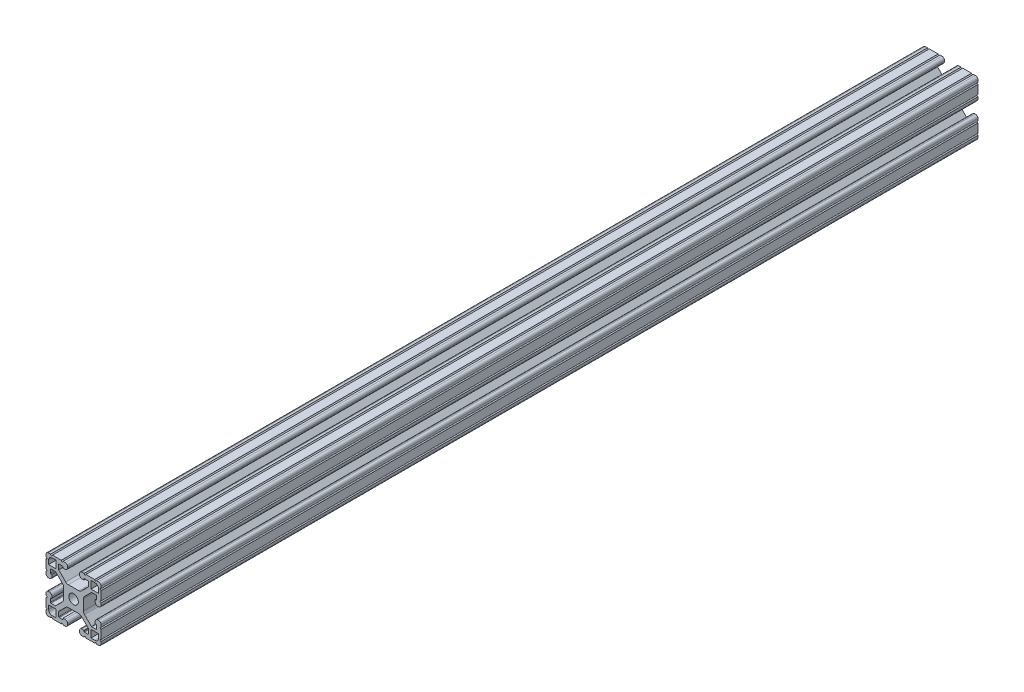
from build123d import *

# Parameters (mm, degrees)
BOSS_EXTRUDE1_DEPTH      = 303.2125
BOSS_EXTRUDE1_DEPTH_BACK = 303.2125
SKETCH3_W                = 38.1
SKETCH3_H                = 38.1
SKETCH4_W                = 5.207
SKETCH4_H                = 5.207
SKETCH4_R                = 3.302
CUT_EXTRUDE1_DEPTH       = 608.023134341
CUT_EXTRUDE2_DEPTH       = 608.023134341
FILLET1_R                = 2.54
FILLET2_R                = 1.778
FILLET3_R                = 0.396875


with BuildPart() as part:
    # Sketch3 → Boss-Extrude1 (new, two sides: drawn at the far end of the back side and taken through both)
    with BuildSketch(Plane.XY.offset(-BOSS_EXTRUDE1_DEPTH_BACK)):
        Rectangle(SKETCH3_W, SKETCH3_H)
    extrude(amount=BOSS_EXTRUDE1_DEPTH + BOSS_EXTRUDE1_DEPTH_BACK)

    # Sketch4 → Cut-Extrude1 (cut, through all)
    with BuildSketch(Plane.XY.offset(303.2125)):
        Polygon((7.239, 14.986), (4.064, 14.986), (4.064, 19.05), (-4.064, 19.05), (-4.064, 14.986), (-7.239, 14.986), (-7.239, 16.002), (-10.287, 16.002), (-10.287, 12.442261469), (-4.702738531, 6.858), (4.702738531, 6.858), (10.287, 12.442261469), (10.287, 16.002), (7.239, 16.002), align=None)
        Polygon((10.287, -12.442261469), (4.702738531, -6.858), (-4.702738531, -6.858), (-10.287, -12.442261469), (-10.287, -16.002), (-7.239, -16.002), (-7.239, -14.986), (-4.064, -14.986), (-4.064, -19.05), (4.064, -19.05), (4.064, -14.986), (7.239, -14.986), (7.239, -16.002), (10.287, -16.002), align=None)
        Polygon((-12.442261469, -10.287), (-6.858, -4.702738531), (-6.858, 4.702738531), (-12.442261469, 10.287), (-16.002, 10.287), (-16.002, 7.239), (-14.986, 7.239), (-14.986, 4.064), (-19.05, 4.064), (-19.05, -4.064), (-14.986, -4.064), (-14.986, -7.239), (-16.002, -7.239), (-16.002, -10.287), align=None)
        Polygon((14.986, -7.239), (14.986, -4.064), (19.05, -4.064), (19.05, 4.064), (14.986, 4.064), (14.986, 7.239), (16.002, 7.239), (16.002, 10.287), (12.442261469, 10.287), (6.858, 4.702738531), (6.858, -4.702738531), (12.442261469, -10.287), (16.002, -10.287), (16.002, -7.239), align=None)
        with Locations((14.6685, 14.6685)):
            Rectangle(SKETCH4_W, SKETCH4_H)
        with Locations((14.6685, -14.6685)):
            Rectangle(SKETCH4_W, SKETCH4_H)
        with Locations((-14.6685, 14.6685)):
            Rectangle(SKETCH4_W, SKETCH4_H)
        with Locations((-14.6685, -14.6685)):
            Rectangle(SKETCH4_W, SKETCH4_H)
        Circle(SKETCH4_R)
    extrude(amount=-CUT_EXTRUDE1_DEPTH, mode=Mode.SUBTRACT)

    # Sketch5 → Cut-Extrude2 (cut, through all)
    with BuildSketch(Plane.XY.offset(303.2125)):
        with BuildLine():
            Line((-14.605, 19.05), (-15.875, 19.05))
            ThreePointArc((-15.875, 19.05), (-15.24, 18.415), (-14.605, 19.05))
        make_face()
        with BuildLine():
            Line((-7.239, 19.05), (-8.509, 19.05))
            ThreePointArc((-8.509, 19.05), (-7.874, 18.415), (-7.239, 19.05))
        make_face()
        with BuildLine():
            ThreePointArc((-19.05, 14.605), (-18.415, 15.24), (-19.05, 15.875))
            Line((-19.05, 15.875), (-19.05, 14.605))
        make_face()
        with BuildLine():
            ThreePointArc((-19.05, 7.239), (-18.415, 7.874), (-19.05, 8.509))
            Line((-19.05, 8.509), (-19.05, 7.239))
        make_face()
        with BuildLine():
            ThreePointArc((7.239, 19.05), (7.874, 18.415), (8.509, 19.05))
            Line((8.509, 19.05), (7.239, 19.05))
        make_face()
        with BuildLine():
            ThreePointArc((14.605, 19.05), (15.24, 18.415), (15.875, 19.05))
            Line((15.875, 19.05), (14.605, 19.05))
        make_face()
        with BuildLine():
            Line((19.05, 14.605), (19.05, 15.875))
            ThreePointArc((19.05, 15.875), (18.415, 15.24), (19.05, 14.605))
        make_face()
        with BuildLine():
            Line((19.05, 7.239), (19.05, 8.509))
            ThreePointArc((19.05, 8.509), (18.415, 7.874), (19.05, 7.239))
        make_face()
        with BuildLine():
            ThreePointArc((19.05, -7.239), (18.415, -7.874), (19.05, -8.509))
            Line((19.05, -8.509), (19.05, -7.239))
        make_face()
        with BuildLine():
            ThreePointArc((19.05, -14.605), (18.415, -15.24), (19.05, -15.875))
            Line((19.05, -15.875), (19.05, -14.605))
        make_face()
        with BuildLine():
            Line((14.605, -19.05), (15.875, -19.05))
            ThreePointArc((15.875, -19.05), (15.24, -18.415), (14.605, -19.05))
        make_face()
        with BuildLine():
            Line((7.239, -19.05), (8.509, -19.05))
            ThreePointArc((8.509, -19.05), (7.874, -18.415), (7.239, -19.05))
        make_face()
        with BuildLine():
            ThreePointArc((-7.239, -19.05), (-7.874, -18.415), (-8.509, -19.05))
            Line((-8.509, -19.05), (-7.239, -19.05))
        make_face()
        with BuildLine():
            ThreePointArc((-14.605, -19.05), (-15.24, -18.415), (-15.875, -19.05))
            Line((-15.875, -19.05), (-14.605, -19.05))
        make_face()
        with BuildLine():
            Line((-19.05, -14.605), (-19.05, -15.875))
            ThreePointArc((-19.05, -15.875), (-18.415, -15.24), (-19.05, -14.605))
        make_face()
        with BuildLine():
            Line((-19.05, -7.239), (-19.05, -8.509))
            ThreePointArc((-19.05, -8.509), (-18.415, -7.874), (-19.05, -7.239))
        make_face()
    extrude(amount=-CUT_EXTRUDE2_DEPTH, mode=Mode.SUBTRACT)

    # Fillet1
    fillet1_edges = [part.edges().sort_by_distance(p)[0] for p in [
        (6.858, -4.702738531, 0),
        (6.858, 4.702738531, 0),
        (-17.272, 17.272, 0),
        (-17.272, -17.272, 0),
        (17.272, -17.272, 0),
        (17.272, 17.272, 0),
        (-4.702738531, -6.858, 0),
        (4.702738531, -6.858, 0),
        (-6.858, 4.702738531, 0),
        (-6.858, -4.702738531, 0),
        (4.702738531, 6.858, 0),
        (-4.702738531, 6.858, 0),
    ]]
    fillet(fillet1_edges, radius=FILLET1_R)

    # Fillet2
    fillet2_edges = [part.edges().sort_by_distance(p)[0] for p in [
        (14.986, 4.064, 0),
        (19.05, 4.064, 0),
        (19.05, -4.064, 0),
        (14.986, -4.064, 0),
        (4.064, -14.986, 0),
        (4.064, -19.05, 0),
        (-4.064, -19.05, 0),
        (-4.064, -14.986, 0),
        (-14.986, -4.064, 0),
        (-19.05, -4.064, 0),
        (-19.05, 4.064, 0),
        (-14.986, 4.064, 0),
        (-19.05, 19.05, 0),
        (19.05, 19.05, 0),
        (19.05, -19.05, 0),
        (-19.05, -19.05, 0),
        (-4.064, 14.986, 0),
        (-4.064, 19.05, 0),
        (4.064, 19.05, 0),
        (4.064, 14.986, 0),
    ]]
    fillet(fillet2_edges, radius=FILLET2_R)

    # Fillet3
    fillet3_edges = [part.edges().sort_by_distance(p)[0] for p in [
        (12.442261469, 10.287, 0),
        (16.002, 10.287, 0),
        (16.002, 7.239, 0),
        (16.002, -7.239, 0),
        (16.002, -10.287, 0),
        (12.442261469, -10.287, 0),
        (-7.239, -16.002, 0),
        (-10.287, -16.002, 0),
        (-10.287, -12.442261469, 0),
        (10.287, -12.442261469, 0),
        (10.287, -16.002, 0),
        (7.239, -16.002, 0),
        (-16.002, 7.239, 0),
        (-16.002, 10.287, 0),
        (-12.442261469, 10.287, 0),
        (-12.442261469, -10.287, 0),
        (-16.002, -10.287, 0),
        (-14.986, -7.239, 0),
        (-10.287, 12.442261469, 0),
        (-10.287, 16.002, 0),
        (-7.239, 16.002, 0),
        (7.239, 16.002, 0),
        (10.287, 16.002, 0),
        (10.287, 12.442261469, 0),
    ]]
    fillet(fillet3_edges, radius=FILLET3_R)


solid = part.part
